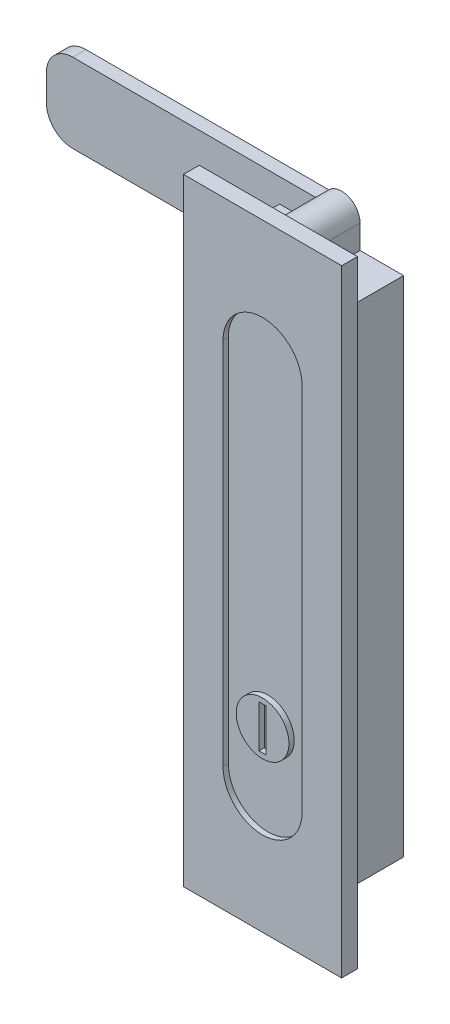
from build123d import *

# Parameters (mm, degrees)
SKETCH_1_W          = 30
SKETCH_1_H          = 117
EXTRUDE_1_DEPTH     = 3
SKETCH_2_R          = 5
CUT_EXTRUDE_1_DEPTH = 1
SKETCH_3_W          = 1.351446616
SKETCH_3_H          = 8.058414564
CUT_EXTRUDE_2_DEPTH = 1
SKETCH_4_W          = 8.25
SKETCH_4_H          = 95.5
SKETCH_4_W_2        = 7
EXTRUDE_2_DEPTH     = 12
EXTRUDE_3_DEPTH     = 2.5


with BuildPart() as part:
    # 草图1 → 凸台-拉伸1 (new body)
    with BuildSketch(Plane.XY):
        Rectangle(SKETCH_1_W, SKETCH_1_H)
    extrude(amount=EXTRUDE_1_DEPTH)

    # 草图2 → 切除-拉伸1 (cut)
    with BuildSketch(Plane.XY.offset(3)):
        with BuildLine():
            Line((-7.5, -35), (-7.5, 35))
            ThreePointArc((-7.5, 35), (0, 42.5), (7.5, 35))
            Line((7.5, 35), (7.5, -35))
            ThreePointArc((7.5, -35), (0, -42.5), (-7.5, -35))
        make_face()
        with Locations((0, -25)):
            Circle(SKETCH_2_R, mode=Mode.SUBTRACT)
    extrude(amount=-CUT_EXTRUDE_1_DEPTH, mode=Mode.SUBTRACT)

    # 草图3 → 切除-拉伸2 (cut)
    with BuildSketch(Plane.XY.offset(3)):
        with Locations((0, -25)):
            Rectangle(SKETCH_3_W, SKETCH_3_H)
    extrude(amount=-CUT_EXTRUDE_2_DEPTH, mode=Mode.SUBTRACT)

    # 草图4 → 凸台-拉伸2 (add)
    with BuildSketch(Plane(origin=(0, 0, 0), x_dir=(-1, 0, 0), z_dir=(0, 0, -1))):
        with Locations((-7.625, 0)):
            Rectangle(SKETCH_4_W, SKETCH_4_H)
        Rectangle(SKETCH_4_W_2, SKETCH_4_H)
        with BuildLine():
            Line((-3.5, 52.25), (-3.5, 47.75))
            Line((-3.5, 47.75), (3.5, 47.75))
            Line((3.5, 47.75), (3.5, 52.25))
            ThreePointArc((3.5, 52.25), (0, 55.75), (-3.5, 52.25))
        make_face()
        with Locations((7.625, 0)):
            Rectangle(SKETCH_4_W, SKETCH_4_H)
        with BuildLine():
            Line((3.5, -47.75), (-3.5, -47.75))
            Line((-3.5, -47.75), (-3.5, -52.25))
            ThreePointArc((-3.5, -52.25), (0, -55.75), (3.5, -52.25))
            Line((3.5, -52.25), (3.5, -47.75))
        make_face()
    extrude(amount=EXTRUDE_2_DEPTH)

    # 草图5 → 凸台-拉伸3 (add)
    with BuildSketch(Plane(origin=(0, 0, -12), x_dir=(-1, 0, 0), z_dir=(0, 0, -1))):
        with BuildLine():
            Line((0, 52.25), (51, 52.25))
            ThreePointArc((51, 52.25), (54.535533906, 50.785533906), (56, 47.25))
            Line((56, 47.25), (56, 42.25))
            ThreePointArc((56, 42.25), (54.535533906, 38.714466094), (51, 37.25))
            Line((51, 37.25), (0, 37.25))
            Line((0, 37.25), (0, 52.25))
        make_face()
    extrude(amount=EXTRUDE_3_DEPTH)


solid = part.part
